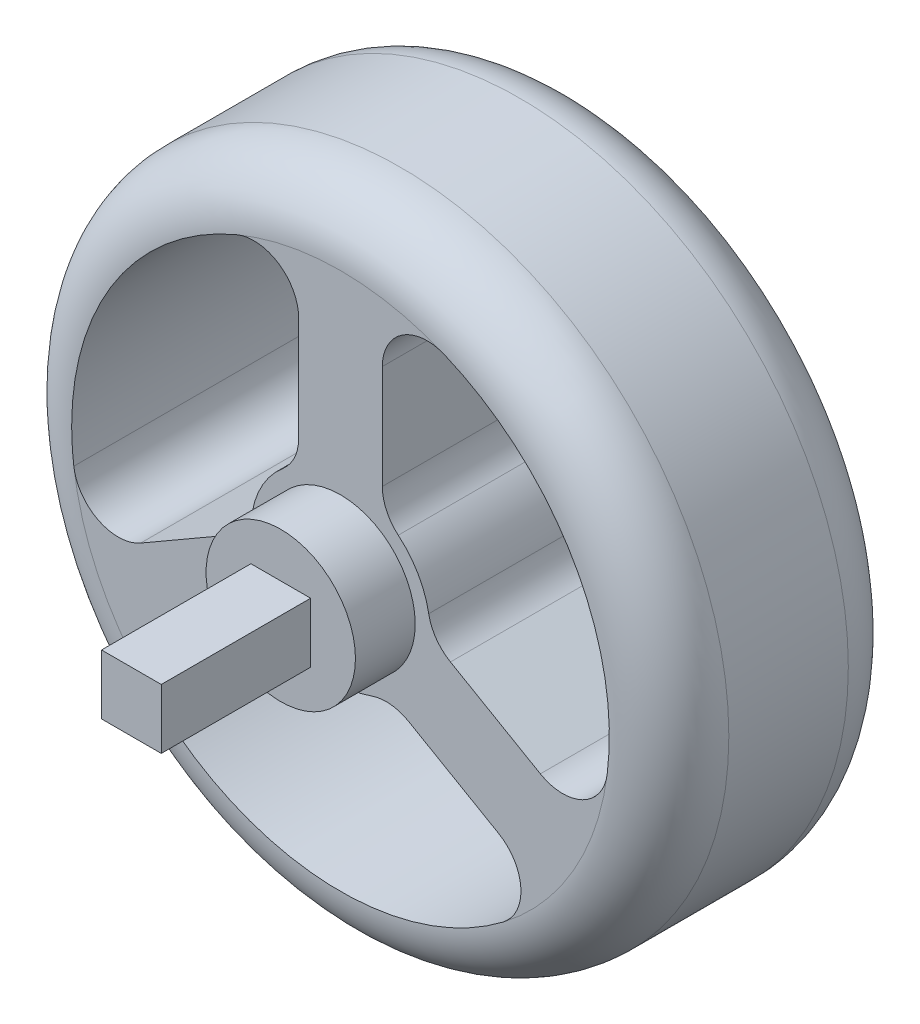
from build123d import *

# Parameters (mm, degrees)
SKETCH1_R           = 27.94
BOSS_EXTRUDE1_DEPTH = 20.32
SKETCH2_R           = 6.35
BOSS_EXTRUDE2_DEPTH = 20.32
BOSS_EXTRUDE3_START = 20.32
SKETCH3_R           = 27.94
BOSS_EXTRUDE3_DEPTH = 20.32
FILLET1_R           = 5.08
FILLET2_R           = 5.08
FILLET3_R           = 5.08
FILLET4_R           = 5.08
CUT_EXTRUDE1_DEPTH  = 73.645776241
SKETCH6_R           = 27.94
CUT_EXTRUDE2_DEPTH  = 57.682420605
SKETCH7_R           = 6.35
CUT_EXTRUDE3_DEPTH  = 5.08
SKETCH9_R           = 6.35
CUT_EXTRUDE5_DEPTH  = 10.16
SKETCH10_W          = 5.08
SKETCH10_H          = 5.08
BOSS_EXTRUDE4_DEPTH = 12.7


with BuildPart() as part:
    # Sketch1 → Boss-Extrude1 (new body)
    with BuildSketch(Plane.XY):
        Circle(SKETCH1_R)
    extrude(amount=BOSS_EXTRUDE1_DEPTH)

    # Sketch2 → Boss-Extrude2 (add)
    with BuildSketch(Plane(origin=(0, 0, 0), x_dir=(-1, 0, 0), z_dir=(0, 0, -1))):
        with Locations(Location((0, 0, 0), (0, 0, 180))):
            Circle(SKETCH2_R)
    extrude(amount=BOSS_EXTRUDE2_DEPTH)

    # Sketch3 → Boss-Extrude3 (add)
    with BuildSketch(Plane(origin=(0, 0, -20.32), x_dir=(-1, 0, 0), z_dir=(0, 0, -1)).offset(BOSS_EXTRUDE3_START)):
        with Locations(Location((0, 0, 0), (0, 0, 180))):
            Circle(SKETCH3_R)
    extrude(amount=-BOSS_EXTRUDE3_DEPTH)

    # Fillet1
    fillet1_edges = [part.edges().sort_by_distance(p)[0] for p in [
        (-27.94, 0, 20.32),
    ]]
    fillet(fillet1_edges, radius=FILLET1_R)

    # Fillet2
    fillet2_edges = [part.edges().sort_by_distance(p)[0] for p in [
        (-27.94, 0, 0),
    ]]
    fillet(fillet2_edges, radius=FILLET2_R)

    # Fillet3
    fillet3_edges = [part.edges().sort_by_distance(p)[0] for p in [
        (-27.94, 0, -20.32),
    ]]
    fillet(fillet3_edges, radius=FILLET3_R)

    # Fillet4
    fillet4_edges = [part.edges().sort_by_distance(p)[0] for p in [
        (-27.94, 0, -40.64),
    ]]
    fillet(fillet4_edges, radius=FILLET4_R)

    # Sketch4 → Cut-Extrude1 (cut, through all)
    with BuildSketch(Plane(origin=(0, 0, -40.64), x_dir=(-1, 0, 0), z_dir=(0, 0, -1))):
        with BuildLine():
            Line((-3.556, 8.739962471), (-3.556, 17.568282329))
            ThreePointArc((-3.556, 17.568282329), (-5.256117539, 20.740741312), (-8.8392, 21.081938795))
            ThreePointArc((-8.8392, 21.081938795), (-19.797340731, 11.43), (-22.677094558, -2.885997648))
            ThreePointArc((-22.677094558, -2.885997648), (-20.590067639, -5.818439342), (-16.992578798, -5.704554829))
            Line((-16.992578798, -5.704554829), (-9.347029528, -1.2903949))
            ThreePointArc((-9.347029528, -1.2903949), (-8.133427478, -0.179541209), (-7.501353019, 1.339441259))
            ThreePointArc((-7.501353019, 1.339441259), (-6.599113577, 3.81), (-4.910666667, 5.826641648))
            ThreePointArc((-4.910666667, 5.826641648), (-3.911226491, 7.13352542), (-3.556, 8.739962471))
        make_face()
        with BuildLine():
            Line((3.556, 8.739962471), (3.556, 17.568282329))
            ThreePointArc((3.556, 17.568282329), (5.256117539, 20.740741312), (8.8392, 21.081938795))
            ThreePointArc((8.8392, 21.081938795), (19.797340731, 11.43), (22.677094558, -2.885997648))
            ThreePointArc((22.677094558, -2.885997648), (20.590067639, -5.818439342), (16.992578798, -5.704554829))
            Line((16.992578798, -5.704554829), (9.347029528, -1.2903949))
            ThreePointArc((9.347029528, -1.2903949), (8.133427478, -0.179541209), (7.501353019, 1.339441259))
            ThreePointArc((7.501353019, 1.339441259), (6.599113577, 3.81), (4.910666667, 5.826641648))
            ThreePointArc((4.910666667, 5.826641648), (3.911226491, 7.13352542), (3.556, 8.739962471))
        make_face()
        with BuildLine():
            Line((5.791029528, -7.449567572), (13.436578798, -11.8637275))
            ThreePointArc((13.436578798, -11.8637275), (15.3339501, -14.92230197), (13.837894558, -18.195941147))
            ThreePointArc((13.837894558, -18.195941147), (0, -22.86), (-13.837894558, -18.195941147))
            ThreePointArc((-13.837894558, -18.195941147), (-15.3339501, -14.92230197), (-13.436578798, -11.8637275))
            Line((-13.436578798, -11.8637275), (-5.791029528, -7.449567572))
            ThreePointArc((-5.791029528, -7.449567572), (-4.222200987, -6.953984211), (-2.590686352, -7.166082907))
            ThreePointArc((-2.590686352, -7.166082907), (0, -7.62), (2.590686352, -7.166082907))
            ThreePointArc((2.590686352, -7.166082907), (4.222200987, -6.953984211), (5.791029528, -7.449567572))
        make_face()
    extrude(amount=-CUT_EXTRUDE1_DEPTH, mode=Mode.SUBTRACT)

    # Sketch6 → Cut-Extrude2 (cut, through all)
    with BuildSketch(Plane(origin=(0, 0, 0), x_dir=(-1, 0, 0), z_dir=(0, 0, -1))):
        Circle(SKETCH6_R)
    extrude(amount=-CUT_EXTRUDE2_DEPTH, mode=Mode.SUBTRACT)

    # Sketch7 → Cut-Extrude3 (cut)
    with BuildSketch(Plane.XY):
        Circle(SKETCH7_R)
    extrude(amount=-CUT_EXTRUDE3_DEPTH, mode=Mode.SUBTRACT)

    # Sketch9 → Cut-Extrude5 (cut)
    with BuildSketch(Plane.XY.offset(-5.08)):
        Circle(SKETCH9_R)
    extrude(amount=-CUT_EXTRUDE5_DEPTH, mode=Mode.SUBTRACT)

    # Sketch10 → Boss-Extrude4 (add)
    with BuildSketch(Plane.XY.offset(-15.24)):
        Rectangle(SKETCH10_W, SKETCH10_H)
    extrude(amount=BOSS_EXTRUDE4_DEPTH)


solid = part.part
